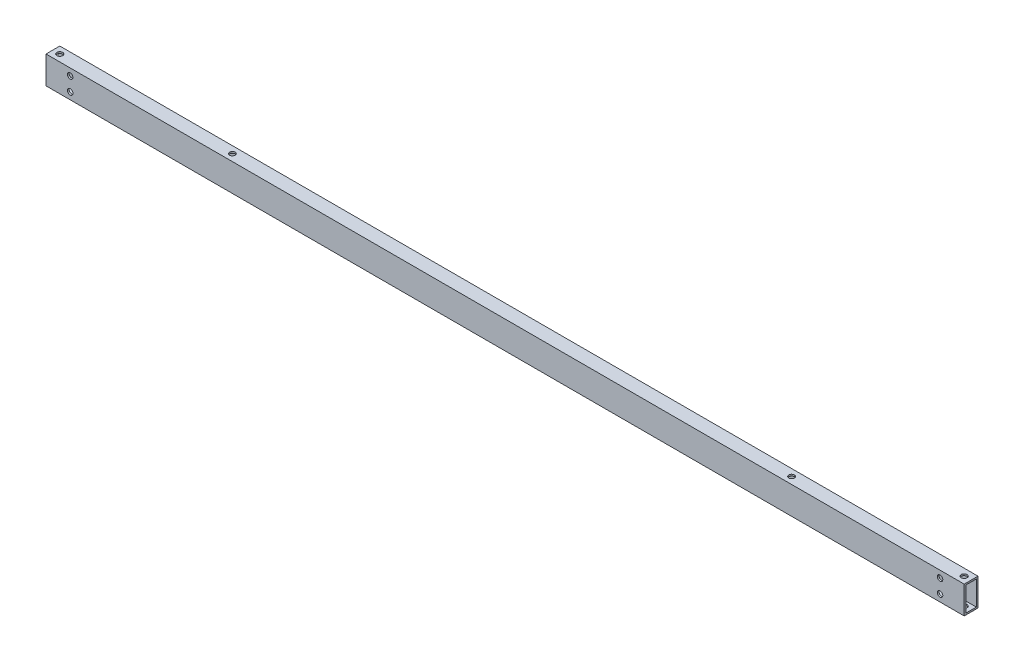
from build123d import *

# Parameters (mm, degrees)
SKETCH_1_W          = 10
SKETCH_1_H          = 20
SKETCH_1_W_2        = 7.6
SKETCH_1_H_2        = 17.6
EXTRUDE_1_DEPTH     = 665
SKETCH_2_R          = 2
CUT_EXTRUDE_1_DEPTH = 666.150358941
SKETCH_3_R          = 2
SKETCH_3_R_2        = 2.1
CUT_EXTRUDE_2_DEPTH = 666.319472134


with BuildPart() as part:
    # ｽｹｯﾁ1 → 押し出し-薄板1 (new body)
    with BuildSketch(Plane(origin=(0, 0, 0), x_dir=(0, 0, -1), z_dir=(1, 0, 0))):
        Rectangle(SKETCH_1_W, SKETCH_1_H)
        Rectangle(SKETCH_1_W_2, SKETCH_1_H_2, mode=Mode.SUBTRACT)
    extrude(amount=EXTRUDE_1_DEPTH)

    # ｽｹｯﾁ2 → ｶｯﾄ - 押し出し1 (cut, through all)
    with BuildSketch(Plane.XY.offset(5)):
        with Locations((647.5, 5)):
            Circle(SKETCH_2_R)
        with Locations(Location((647.5, -5, 0), (0, 0, 90))):
            Circle(SKETCH_2_R)
        with Locations((17.5, -5)):
            Circle(SKETCH_2_R)
        with Locations(Location((17.5, 5, 0), (0, 0, 90))):
            Circle(SKETCH_2_R)
    extrude(amount=-CUT_EXTRUDE_1_DEPTH, mode=Mode.SUBTRACT)

    # ｽｹｯﾁ3 → ｶｯﾄ - 押し出し2 (cut, through all)
    with BuildSketch(Plane(origin=(0, 10, 0), x_dir=(1, 0, 0), z_dir=(0, 1, 0))):
        with Locations(Location((130, 0, 0), (0, 0, 270))):
            Circle(SKETCH_3_R)
        with Locations(Location((535, 0, 0), (0, 0, 270))):
            Circle(SKETCH_3_R)
        with Locations(Location((5, 0, 0), (0, 0, 270))):
            Circle(SKETCH_3_R_2)
        with Locations(Location((660, 0, 0), (0, 0, 270))):
            Circle(SKETCH_3_R_2)
    extrude(amount=-CUT_EXTRUDE_2_DEPTH, mode=Mode.SUBTRACT)


solid = part.part
